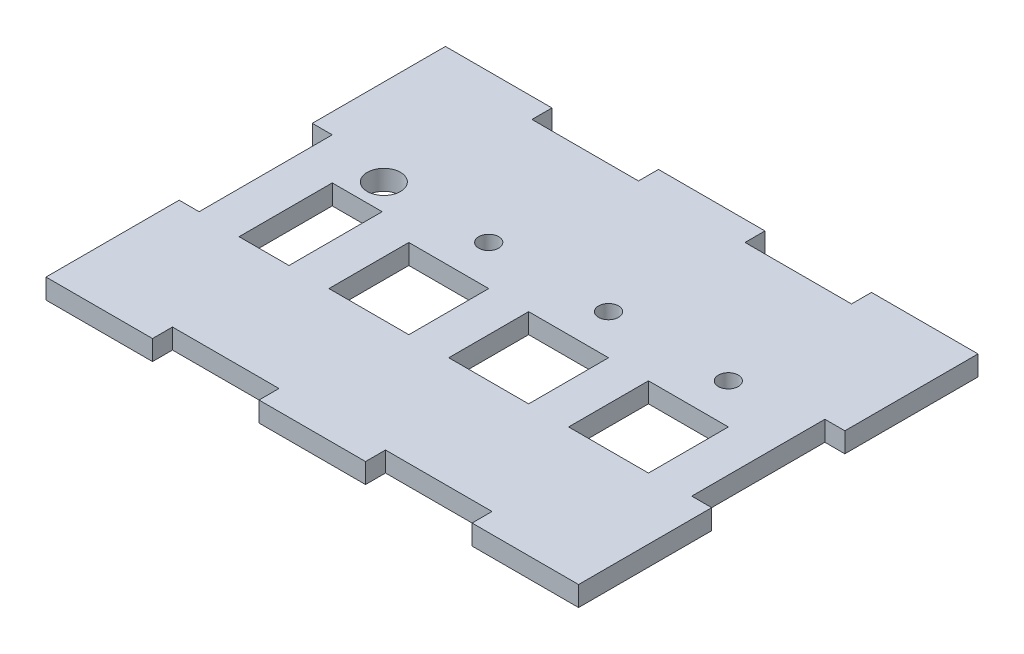
from build123d import *

# Parameters (mm, degrees)
TOP_AND_BOTTOM_R              = 1.5
TOP_AND_BOTTOM_R_2            = 2.5
TOP_AND_BOTTOM_W              = 12
TOP_AND_BOTTOM_H              = 12
TOP_AND_BOTTOM_W_2            = 7.5
TOP_AND_BOTTOM_H_2            = 14
TOP_AND_BOTTOM_EXTRUDED_DEPTH = 3


with BuildPart() as part:
    # Top and Bottom → Top and Bottom Extruded (new body)
    with BuildSketch(Plane(origin=(0, 0, 0), x_dir=(1, 0, 0), z_dir=(0, 1, 0))):
        Polygon((32, 60), (48, 60), (48, 57), (64, 57), (64, 60), (80, 60), (80, 40), (77, 40), (77, 20), (80, 20), (80, 0), (64, 0), (64, 3), (48, 3), (48, 0), (32, 0), (32, 3), (16, 3), (16, 0), (0, 0), (0, 20), (3, 20), (3, 40), (0, 40), (0, 60), (16, 60), (16, 57), (32, 57), align=None)
        with Locations(Location((28.75, 37.75, 0), (0, 0, 270))):
            Circle(TOP_AND_BOTTOM_R, mode=Mode.SUBTRACT)
        with Locations(Location((46.75, 37.75, 0), (0, 0, 270))):
            Circle(TOP_AND_BOTTOM_R, mode=Mode.SUBTRACT)
        with Locations(Location((64.75, 37.75, 0), (0, 0, 270))):
            Circle(TOP_AND_BOTTOM_R, mode=Mode.SUBTRACT)
        with Locations(Location((13, 37.75, 0), (0, 0, 270))):
            Circle(TOP_AND_BOTTOM_R_2, mode=Mode.SUBTRACT)
        with Locations((46.75, 25.75)):
            Rectangle(TOP_AND_BOTTOM_W, TOP_AND_BOTTOM_H, mode=Mode.SUBTRACT)
        with Locations((28.75, 25.75)):
            Rectangle(TOP_AND_BOTTOM_W, TOP_AND_BOTTOM_H, mode=Mode.SUBTRACT)
        with Locations((64.75, 25.75)):
            Rectangle(TOP_AND_BOTTOM_W, TOP_AND_BOTTOM_H, mode=Mode.SUBTRACT)
        with Locations((13, 26.75)):
            Rectangle(TOP_AND_BOTTOM_W_2, TOP_AND_BOTTOM_H_2, mode=Mode.SUBTRACT)
    extrude(amount=TOP_AND_BOTTOM_EXTRUDED_DEPTH)


solid = part.part
